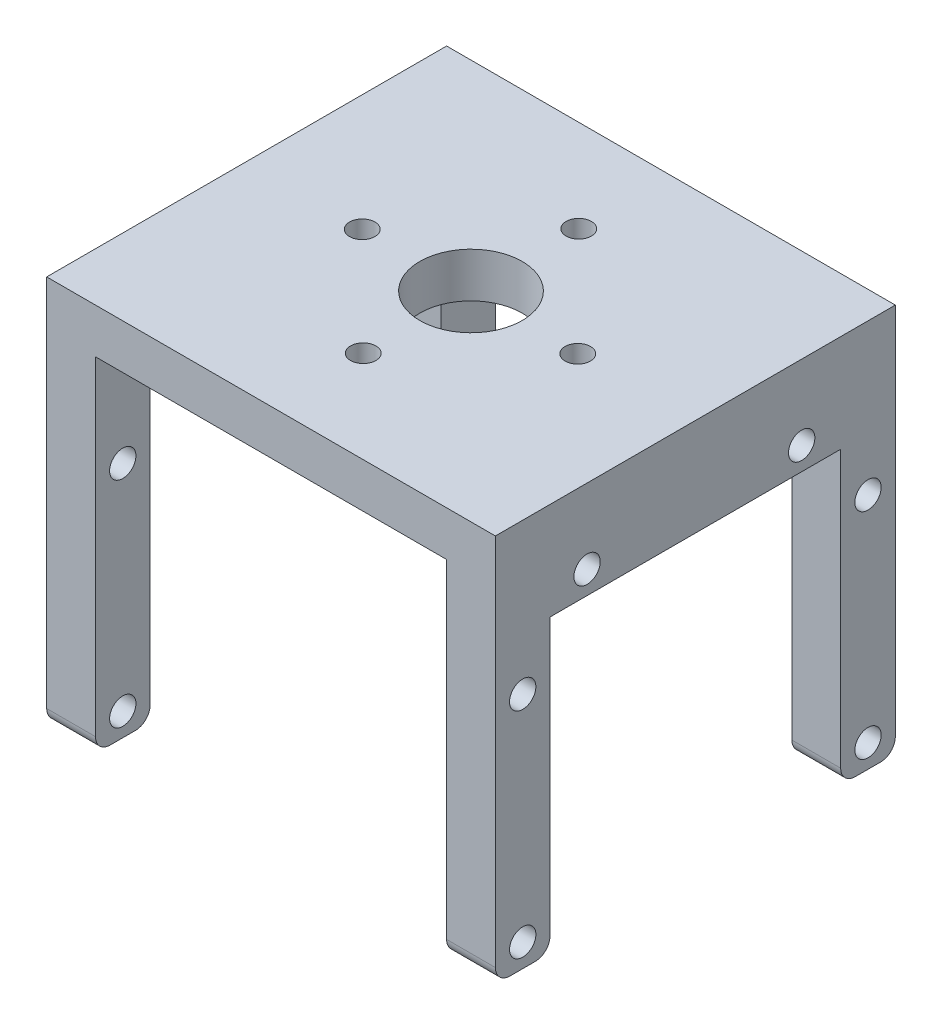
from build123d import *

# Parameters (mm, degrees)
BOSS_EXTRUDE1_DEPTH = 41
SKETCH2_W           = 5
SKETCH2_H           = 5.6
BOSS_EXTRUDE2_DEPTH = 29.82
FILLET1_R           = 1.5
SKETCH3_R           = 1.35
CUT_EXTRUDE1_DEPTH  = 49
SKETCH4_R           = 1.35
CUT_EXTRUDE2_DEPTH  = 49
SKETCH5_R           = 1.3
SKETCH5_R_2         = 5.25
CUT_EXTRUDE3_DEPTH  = 7


with BuildPart() as part:
    # Sketch1 → Boss-Extrude1 (new body)
    with BuildSketch(Plane.XY):
        Polygon((-17.875, 0.24625), (-12.875, 0.24625), (-12.875, 5.65625), (23.125, 5.65625), (23.125, 0.24625), (28.125, 0.24625), (28.125, 10.24625), (-17.875, 10.24625), align=None)
    extrude(amount=BOSS_EXTRUDE1_DEPTH)

    # Sketch2 → Boss-Extrude2 (add)
    with BuildSketch(Plane.XZ.offset(-0.24625)):
        with Locations((-15.375, 2.8)):
            Rectangle(SKETCH2_W, SKETCH2_H)
        with Locations((-15.375, 38.2)):
            Rectangle(SKETCH2_W, SKETCH2_H)
        with Locations((25.625, 38.2)):
            Rectangle(SKETCH2_W, SKETCH2_H)
        with Locations((25.625, 2.8)):
            Rectangle(SKETCH2_W, SKETCH2_H)
    extrude(amount=BOSS_EXTRUDE2_DEPTH)

    # Fillet1
    fillet1_edges = [part.edges().sort_by_distance(p)[0] for p in [
        (-15.375, -29.57375, 0),
        (-15.375, -29.57375, 5.6),
        (-15.375, -29.57375, 35.4),
        (-15.375, -29.57375, 41),
        (25.625, -29.57375, 41),
        (25.625, -29.57375, 35.4),
        (25.625, -29.57375, 5.6),
        (25.625, -29.57375, 0),
    ]]
    fillet(fillet1_edges, radius=FILLET1_R)

    # Sketch3 → Cut-Extrude1 (cut)
    with BuildSketch(Plane.ZY.offset(17.875)):
        with Locations(Location((38.2, -27.20375, 0), (0, 0, 270))):
            Circle(SKETCH3_R)
        with Locations(Location((2.8, -27.20375, 0), (0, 0, 270))):
            Circle(SKETCH3_R)
        with Locations(Location((38.2, -5.20375, 0), (0, 0, 270))):
            Circle(SKETCH3_R)
        with Locations(Location((2.8, -5.20375, 0), (0, 0, 270))):
            Circle(SKETCH3_R)
    extrude(amount=-CUT_EXTRUDE1_DEPTH, mode=Mode.SUBTRACT)

    # Sketch4 → Cut-Extrude2 (cut)
    with BuildSketch(Plane(origin=(28.125, 0, 0), x_dir=(0, 0, -1), z_dir=(1, 0, 0))):
        with Locations((-9.6, 2.59625)):
            Circle(SKETCH4_R)
        with Locations((-31.6, 2.59625)):
            Circle(SKETCH4_R)
    extrude(amount=-CUT_EXTRUDE2_DEPTH, mode=Mode.SUBTRACT)

    # Sketch5 → Cut-Extrude3 (cut)
    with BuildSketch(Plane(origin=(0, 10.24625, 0), x_dir=(1, 0, 0), z_dir=(0, 1, 0))):
        with Locations(Location((5.125, -9.45, 0), (0, 0, 180))):
            Circle(SKETCH5_R)
        with Locations(Location((-5.924547539, -20.599995905, 0), (0, 0, 180))):
            Circle(SKETCH5_R)
        with Locations(Location((5.125, -31.55, 0), (0, 0, 180))):
            Circle(SKETCH5_R)
        with Locations(Location((16.174547539, -20.599995905, 0), (0, 0, 180))):
            Circle(SKETCH5_R)
        with Locations(Location((5.125, -20.5, 0), (0, 0, 180))):
            Circle(SKETCH5_R_2)
    extrude(amount=-CUT_EXTRUDE3_DEPTH, mode=Mode.SUBTRACT)


solid = part.part
